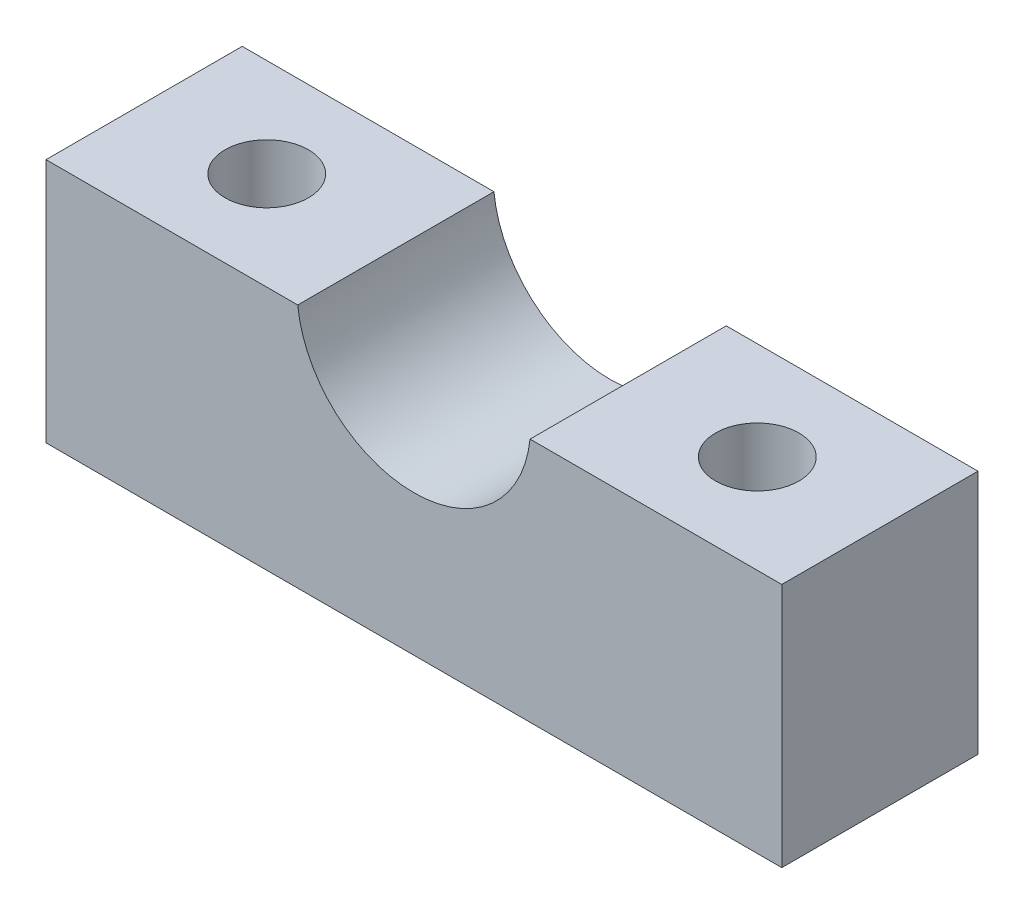
from build123d import *

# Parameters (mm, degrees)
SKETCH1_W            = 30
SKETCH1_H            = 8
BOSS_EXTRUDE1_DEPTH  = 10
M3_CLEARANCE_HOLE1_D = 3.4
CUT_EXTRUDE1_DEPTH   = 20.723082923


with BuildPart() as part:
    # Sketch1 → Boss-Extrude1 (new body)
    with BuildSketch(Plane(origin=(0, 0, 0), x_dir=(1, 0, 0), z_dir=(0, 1, 0))):
        Rectangle(SKETCH1_W, SKETCH1_H)
    extrude(amount=-BOSS_EXTRUDE1_DEPTH)

    # M3 Clearance Hole1 (through all)
    with Locations(Plane(origin=(0, 0, 0), x_dir=(-1, 0, 0), z_dir=(0, 1, 0))):
        with Locations((10, 0), (-10, 0)):
            Hole(M3_CLEARANCE_HOLE1_D / 2)

    # Sketch2 → Cut-Extrude1 (cut, through all)
    with BuildSketch(Plane.XY.offset(4)):
        with BuildLine():
            Line((-4.736180555, 0), (4.736180555, 0))
            ThreePointArc((4.736180555, 0), (0, -4.2625), (-4.736180555, 0))
        make_face()
    extrude(amount=-CUT_EXTRUDE1_DEPTH, mode=Mode.SUBTRACT)


solid = part.part
